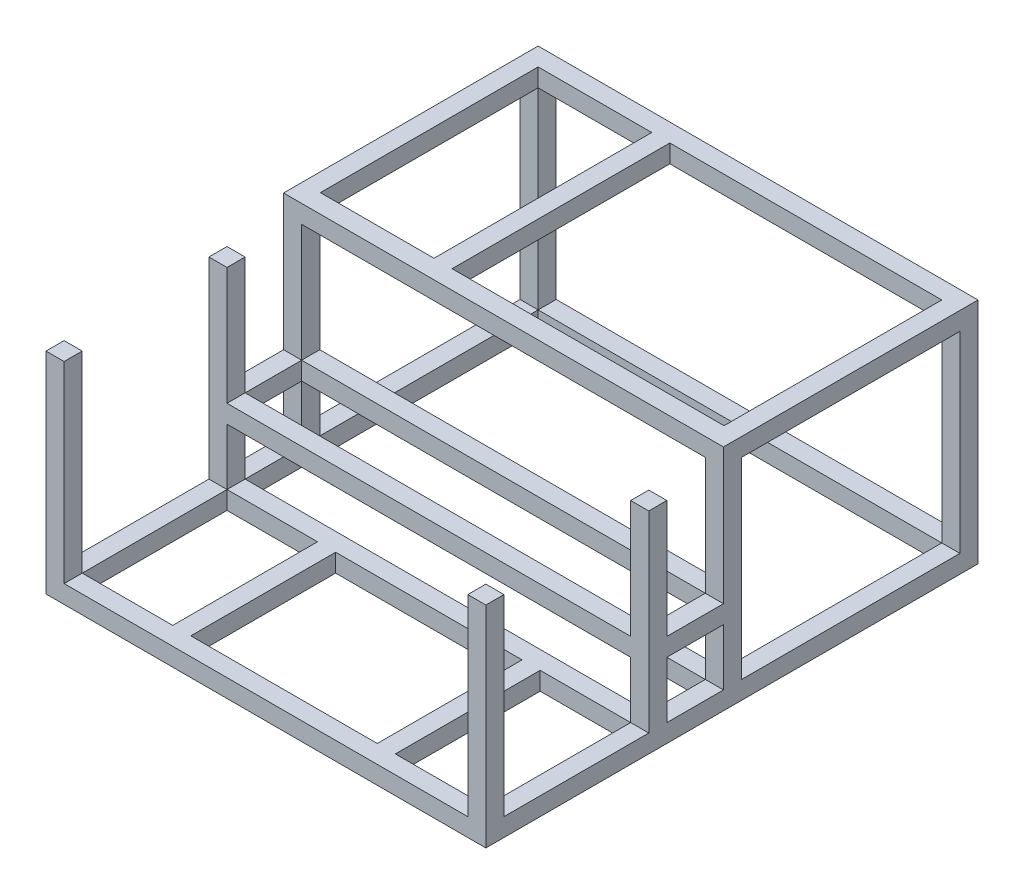
from build123d import *

# Parameters (mm, degrees)
SKETCH1_W           = 690.5625
SKETCH1_H           = 320.675
SKETCH1_W_2         = 639.7625
SKETCH1_H_2         = 269.875
SKETCH1_W_3         = 25.4
SKETCH1_W_4         = 79.375
SKETCH1_H_3         = 25.4
BOSS_EXTRUDE1_DEPTH = 617.22
SKETCH2_W           = 566.42
SKETCH2_H           = 269.875
CUT_EXTRUDE1_DEPTH  = 981.137516082
BOSS_EXTRUDE2_DEPTH = 566.42
CUT_EXTRUDE2_REACH  = 741.293
SKETCH6_W           = 566.42
SKETCH6_H           = 79.375
SKETCH7_W           = 127
SKETCH7_H           = 203.2
SKETCH7_W_2         = 261.62
CUT_EXTRUDE3_DEPTH  = 773.950070043
CUT_EXTRUDE4_REACH  = 785.005
SKETCH8_W           = 566.42
SKETCH8_H           = 307.975
CUT_EXTRUDE6_REACH  = 785.005
SKETCH9_W           = 159.433185108
SKETCH9_H           = 305.57390625
SKETCH9_W_2         = 381.586814892
CUT_EXTRUDE8_REACH  = 774.95
SKETCH10_W          = 566.42
SKETCH10_H          = 306.3875
CUT_EXTRUDE10_REACH = 774.95
SKETCH12_W          = 566.42
SKETCH12_H          = 79.375
SKETCH13_W          = 617.22
SKETCH13_H          = 333.375
CUT_EXTRUDE13_DEPTH = 25.4


with BuildPart() as part:
    # Sketch1 → Boss-Extrude1 (new body)
    # profile 1 of 4: a face of its own
    with BuildSketch(Plane(origin=(0, 0, 0), x_dir=(0, 0, -1), z_dir=(1, 0, 0))):
        with Locations((-14.30734375, -160.3375)):
            Rectangle(SKETCH1_W, SKETCH1_H)
        with Locations((-14.30734375, -160.3375)):
            Rectangle(SKETCH1_W_2, SKETCH1_H_2, mode=Mode.SUBTRACT)
    # profile 2 of 4: a face of its own
    with BuildSketch(Plane(origin=(0, 0, 0), x_dir=(0, 0, -1), z_dir=(1, 0, 0))):
        Polygon((-0.81359375, -25.4), (-26.21359375, -25.4), (-26.21359375, -190.5), (-26.21359375, -215.9), (-26.21359375, -295.275), (-0.81359375, -295.275), align=None)
    # profile 3 of 4: a face of its own
    with BuildSketch(Plane(origin=(0, 0, 0), x_dir=(0, 0, -1), z_dir=(1, 0, 0))):
        with Locations((-118.28859375, -160.3375)):
            Rectangle(SKETCH1_W_3, SKETCH1_H_2)
    # profile 4 of 4: a face of its own
    with BuildSketch(Plane(origin=(0, 0, 0), x_dir=(0, 0, -1), z_dir=(1, 0, 0))):
        with Locations((-65.90109375, -203.2)):
            Rectangle(SKETCH1_W_4, SKETCH1_H_3)
    extrude(amount=BOSS_EXTRUDE1_DEPTH)

    # Sketch2 → Cut-Extrude1 (cut, through all)
    with BuildSketch(Plane.XY.offset(359.58859375)):
        with Locations((308.61, -160.3375)):
            Rectangle(SKETCH2_W, SKETCH2_H)
    extrude(amount=-CUT_EXTRUDE1_DEPTH, mode=Mode.SUBTRACT)

    # Sketch4 → Boss-Extrude2 (add)
    with BuildSketch(Plane(origin=(25.4, 0, 0), x_dir=(0, 0, -1), z_dir=(1, 0, 0))):
        Polygon((-26.21359375, -190.5), (-0.81359375, -190.5), (-0.81359375, -215.87774991), (-130.98859375, -215.87774991), (-130.98859375, -190.5), align=None)
    extrude(amount=BOSS_EXTRUDE2_DEPTH)

    # Sketch6 → Cut-Extrude2 (cut, up to next)
    with BuildSketch(Plane(origin=(0, -190.5, 0), x_dir=(1, 0, 0), z_dir=(0, 1, 0)), mode=Mode.PRIVATE) as cut_extrude2_sk1:
        with Locations((308.61, -65.90109375)):
            Rectangle(SKETCH6_W, SKETCH6_H)
    cut_extrude2_tool1 = extrude(cut_extrude2_sk1.sketch, amount=-CUT_EXTRUDE2_REACH, mode=Mode.PRIVATE) & part.part
    add(cut_extrude2_tool1.solids().sort_by_distance((308.61, -190.5, 65.901094))[0], mode=Mode.SUBTRACT)

    # Sketch7 → Cut-Extrude3 (cut, through all)
    with BuildSketch(Plane(origin=(0, -295.275, 0), x_dir=(1, 0, 0), z_dir=(0, 1, 0))):
        with Locations((528.32, -232.58859375)):
            Rectangle(SKETCH7_W, SKETCH7_H)
        with Locations((88.9, -232.58859375)):
            Rectangle(SKETCH7_W, SKETCH7_H)
        with Locations((308.61, -232.58859375)):
            Rectangle(SKETCH7_W_2, SKETCH7_H)
    extrude(amount=-CUT_EXTRUDE3_DEPTH, mode=Mode.SUBTRACT)

    # Sketch8 → Cut-Extrude4 (cut, up to next)
    with BuildSketch(Plane(origin=(0, 0, 0), x_dir=(1, 0, 0), z_dir=(0, 1, 0)), mode=Mode.PRIVATE) as cut_extrude4_sk1:
        with Locations((308.61, -180.20109375)):
            Rectangle(SKETCH8_W, SKETCH8_H)
    cut_extrude4_tool1 = extrude(cut_extrude4_sk1.sketch, amount=-CUT_EXTRUDE4_REACH, mode=Mode.PRIVATE) & part.part
    add(cut_extrude4_tool1.solids().sort_by_distance((308.61, 0, 180.201094))[0], mode=Mode.SUBTRACT)

    # Sketch9 → Cut-Extrude6 (cut, up to next)
    with BuildSketch(Plane(origin=(0, 0, 0), x_dir=(1, 0, 0), z_dir=(0, 1, 0)), mode=Mode.PRIVATE) as cut_extrude6_sk1:
        with Locations((105.116592554, 152.786953125)):
            Rectangle(SKETCH9_W, SKETCH9_H)
    cut_extrude6_tool1 = extrude(cut_extrude6_sk1.sketch, amount=-CUT_EXTRUDE6_REACH, mode=Mode.PRIVATE) & part.part
    # Sketch9 → Cut-Extrude6 (cut, up to next)
    with BuildSketch(Plane(origin=(0, 0, 0), x_dir=(1, 0, 0), z_dir=(0, 1, 0)), mode=Mode.PRIVATE) as cut_extrude6_sk2:
        with Locations((401.026592554, 152.786953125)):
            Rectangle(SKETCH9_W_2, SKETCH9_H)
    cut_extrude6_tool2 = extrude(cut_extrude6_sk2.sketch, amount=-CUT_EXTRUDE6_REACH, mode=Mode.PRIVATE) & part.part
    add(cut_extrude6_tool1.solids().sort_by_distance((105.116593, 0, -152.786953))[0], mode=Mode.SUBTRACT)
    add(cut_extrude6_tool2.solids().sort_by_distance((401.026593, 0, -152.786953))[0], mode=Mode.SUBTRACT)

    # Sketch10 → Cut-Extrude8 (cut, up to next)
    with BuildSketch(Plane(origin=(0, -295.275, 0), x_dir=(1, 0, 0), z_dir=(0, 1, 0)), mode=Mode.PRIVATE) as cut_extrude8_sk1:
        with Locations((308.61, 152.38015625)):
            Rectangle(SKETCH10_W, SKETCH10_H)
    cut_extrude8_tool1 = extrude(cut_extrude8_sk1.sketch, amount=-CUT_EXTRUDE8_REACH, mode=Mode.PRIVATE) & part.part
    add(cut_extrude8_tool1.solids().sort_by_distance((308.61, -295.275, -152.380156))[0], mode=Mode.SUBTRACT)

    # Sketch12 → Cut-Extrude10 (cut, up to next)
    with BuildSketch(Plane(origin=(0, -295.275, 0), x_dir=(1, 0, 0), z_dir=(0, 1, 0)), mode=Mode.PRIVATE) as cut_extrude10_sk1:
        with Locations((308.61, -65.90109375)):
            Rectangle(SKETCH12_W, SKETCH12_H)
    cut_extrude10_tool1 = extrude(cut_extrude10_sk1.sketch, amount=-CUT_EXTRUDE10_REACH, mode=Mode.PRIVATE) & part.part
    add(cut_extrude10_tool1.solids().sort_by_distance((308.61, -295.275, 65.901094))[0], mode=Mode.SUBTRACT)

    # Sketch13 → Cut-Extrude13 (cut)
    with BuildSketch(Plane(origin=(0, 0, 0), x_dir=(1, 0, 0), z_dir=(0, 1, 0))):
        with Locations((308.61, -192.90109375)):
            Rectangle(SKETCH13_W, SKETCH13_H)
    extrude(amount=-CUT_EXTRUDE13_DEPTH, mode=Mode.SUBTRACT)


solid = part.part
